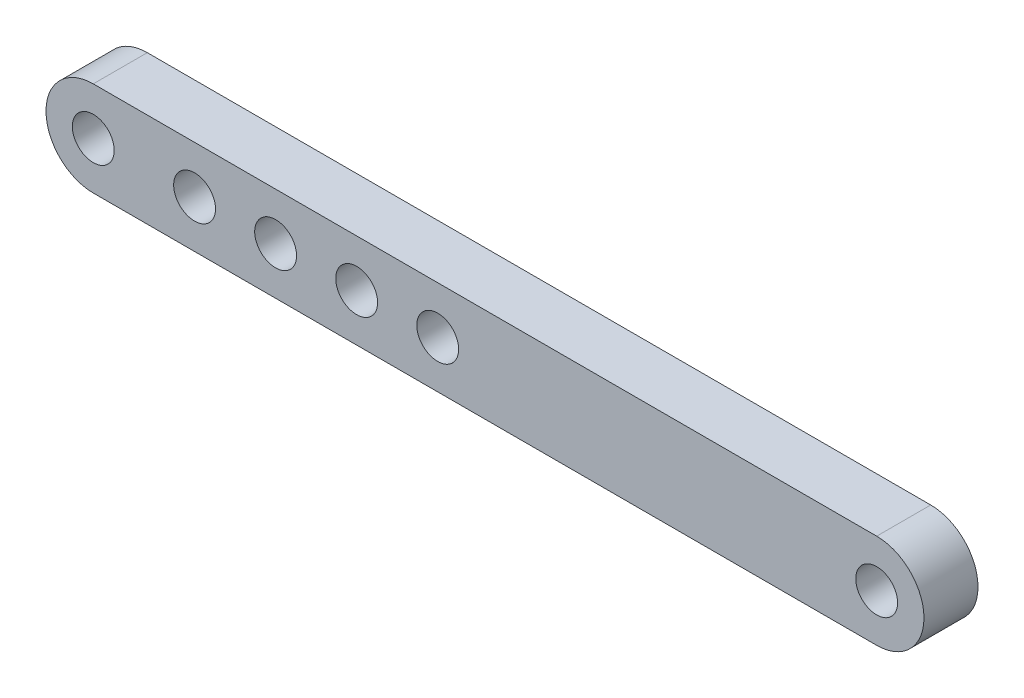
from build123d import *

# Parameters (mm, degrees)
BOSS_EXTRUDE1_DEPTH = 4
SKETCH2_R           = 1.55
CUT_EXTRUDE6_DEPTH  = 38.1913603


with BuildPart() as part:
    # Sketch1 → Boss-Extrude1 (new body)
    with BuildSketch(Plane.XY):
        with BuildLine():
            Line((-33.309608541, 3.5), (24.690391459, 3.5))
            ThreePointArc((24.690391459, 3.5), (28.190391459, 0), (24.690391459, -3.5))
            Line((24.690391459, -3.5), (-33.309608541, -3.5))
            ThreePointArc((-33.309608541, -3.5), (-36.809608541, 0), (-33.309608541, 3.5))
        make_face()
    extrude(amount=BOSS_EXTRUDE1_DEPTH)

    # Sketch2 → Cut-Extrude6 (cut, through all)
    with BuildSketch(Plane.XY):
        with Locations((-33.309608541, 0)):
            Circle(SKETCH2_R)
        with Locations((-19.809608541, 0)):
            Circle(SKETCH2_R)
        with Locations((24.690391459, 0)):
            Circle(SKETCH2_R)
        with Locations((-25.809608541, 0)):
            Circle(SKETCH2_R)
        with Locations((-13.809608541, 0)):
            Circle(SKETCH2_R)
        with Locations((-7.809608541, 0)):
            Circle(SKETCH2_R)
    extrude(amount=CUT_EXTRUDE6_DEPTH, mode=Mode.SUBTRACT)


solid = part.part
